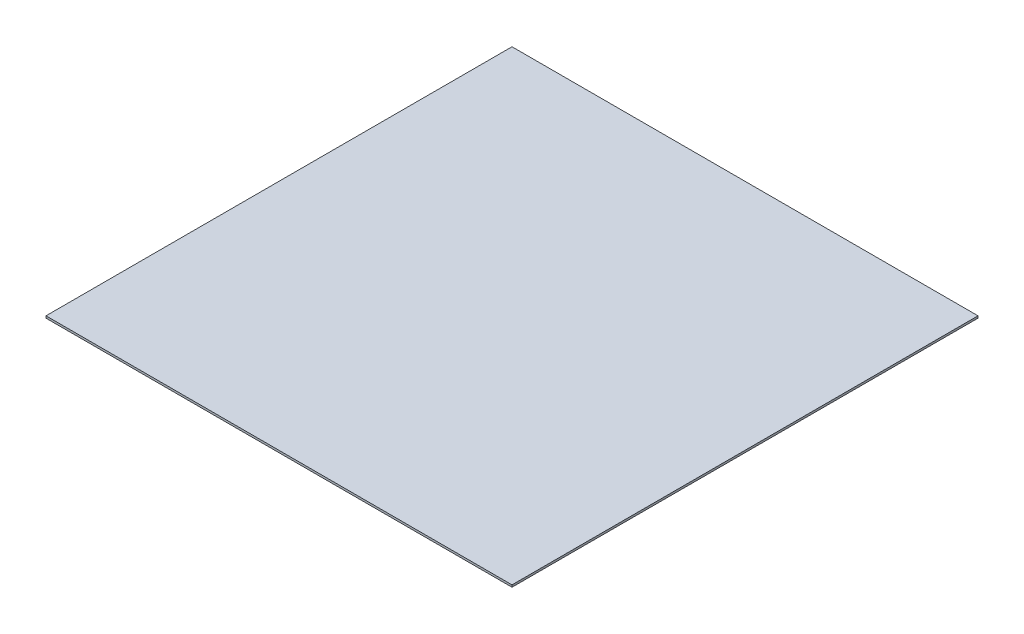
from build123d import *

# Parameters (mm, degrees)
SKETCH1_W           = 711.2
SKETCH1_H           = 711.2
BOSS_EXTRUDE1_DEPTH = 3.175


with BuildPart() as part:
    # Sketch1 → Boss-Extrude1 (new body)
    with BuildSketch(Plane(origin=(0, 0, 0), x_dir=(1, 0, 0), z_dir=(0, 1, 0))):
        with Locations((693.334645702, -88.400231346)):
            Rectangle(SKETCH1_W, SKETCH1_H)
    extrude(amount=BOSS_EXTRUDE1_DEPTH)


solid = part.part
